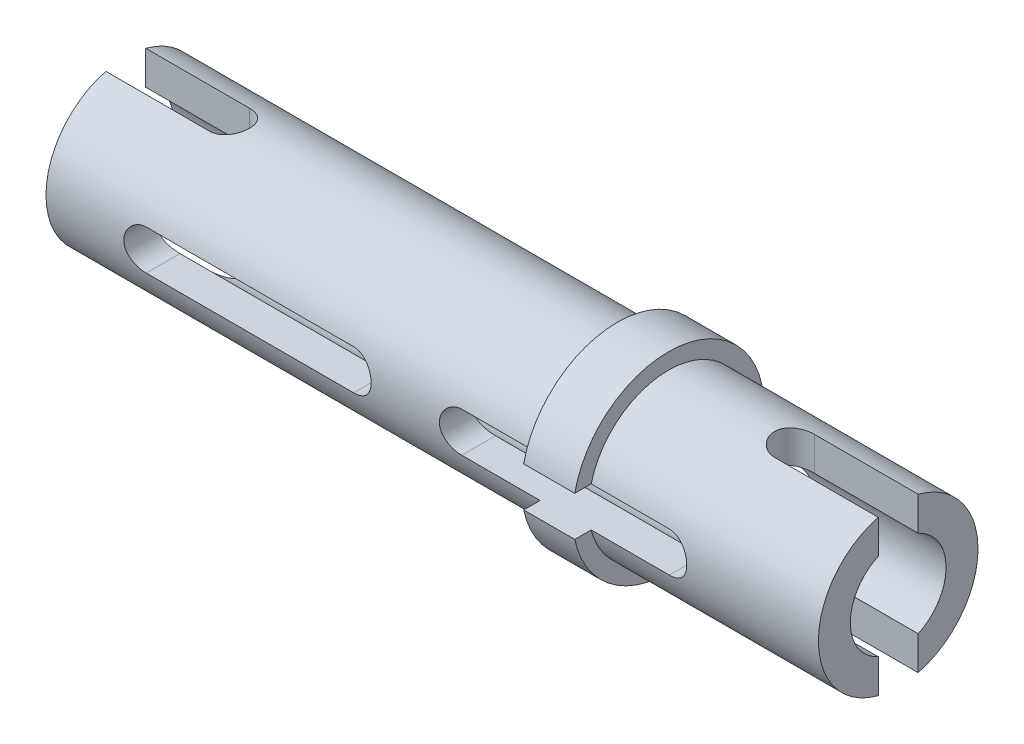
from build123d import *

# Parameters (mm, degrees)
SKETCH1_R                = 3
BOSS_EXTRUDE1_DEPTH      = 0.8
BOSS_EXTRUDE2_DEPTH      = 7.2
BOSS_EXTRUDE2_DEPTH_BACK = 17
SKETCH2_R                = 2.5
CUT_EXTRUDE1_DEPTH       = 17.746342884
CUT_EXTRUDE1_DEPTH_BACK  = 17.746342884
SKETCH4_R                = 1.5
CUT_EXTRUDE2_DEPTH       = 25.561135557
CUT_EXTRUDE3_DEPTH       = 17.734675923
CUT_EXTRUDE3_DEPTH_BACK  = 17.734675923


with BuildPart() as part:
    # Sketch1 → Boss-Extrude1 (new, symmetric)
    with BuildSketch(Plane(origin=(0, 0, 0), x_dir=(0, 0, -1), z_dir=(1, 0, 0))):
        Circle(SKETCH1_R)
    extrude(amount=BOSS_EXTRUDE1_DEPTH, both=True)

    # Sketch2 → Boss-Extrude2 (add, two sides: drawn at the far end of the back side and taken through both)
    with BuildSketch(Plane(origin=(0.8, 0, 0), x_dir=(0, 0, -1), z_dir=(1, 0, 0)).offset(-BOSS_EXTRUDE2_DEPTH_BACK)):
        Circle(SKETCH2_R)
    extrude(amount=BOSS_EXTRUDE2_DEPTH + BOSS_EXTRUDE2_DEPTH_BACK)

    # Sketch3 → Cut-Extrude1 (cut, two sides: drawn at the far end of the back side and taken through both)
    with BuildSketch(Plane.XY.offset(-CUT_EXTRUDE1_DEPTH_BACK)):
        with BuildLine():
            Line((-3.25, 0.625), (3.25, 0.625))
            ThreePointArc((3.25, 0.625), (3.875, 0), (3.25, -0.625))
            Line((3.25, -0.625), (-3.25, -0.625))
            ThreePointArc((-3.25, -0.625), (-3.875, 0), (-3.25, 0.625))
        make_face()
        with BuildLine():
            Line((-13.139009245, 0.625), (-6.639009245, 0.625))
            ThreePointArc((-6.639009245, 0.625), (-6.014009245, 0), (-6.639009245, -0.625))
            Line((-6.639009245, -0.625), (-13.139009245, -0.625))
            ThreePointArc((-13.139009245, -0.625), (-13.764009245, 0), (-13.139009245, 0.625))
        make_face()
    extrude(amount=CUT_EXTRUDE1_DEPTH + CUT_EXTRUDE1_DEPTH_BACK, mode=Mode.SUBTRACT)

    # Sketch4 → Cut-Extrude2 (cut, through all)
    with BuildSketch(Plane(origin=(8, 0, 0), x_dir=(0, 0, -1), z_dir=(1, 0, 0))):
        Circle(SKETCH4_R)
    extrude(amount=-CUT_EXTRUDE2_DEPTH, mode=Mode.SUBTRACT)

    # Sketch5 → Cut-Extrude3 (cut, two sides: drawn at the far end of the back side and taken through both)
    with BuildSketch(Plane(origin=(0, 0, 0), x_dir=(1, 0, 0), z_dir=(0, 1, 0)).offset(-CUT_EXTRUDE3_DEPTH_BACK)):
        with BuildLine():
            Line((-19.45, 0.625), (-12.95, 0.625))
            ThreePointArc((-12.95, 0.625), (-12.325, 0), (-12.95, -0.625))
            Line((-12.95, -0.625), (-19.45, -0.625))
            ThreePointArc((-19.45, -0.625), (-20.075, 0), (-19.45, 0.625))
        make_face()
        with BuildLine():
            Line((11.25, -0.625), (4.75, -0.625))
            ThreePointArc((4.75, -0.625), (4.125, 0), (4.75, 0.625))
            Line((4.75, 0.625), (11.25, 0.625))
            ThreePointArc((11.25, 0.625), (11.875, 0), (11.25, -0.625))
        make_face()
    extrude(amount=CUT_EXTRUDE3_DEPTH + CUT_EXTRUDE3_DEPTH_BACK, mode=Mode.SUBTRACT)


solid = part.part
